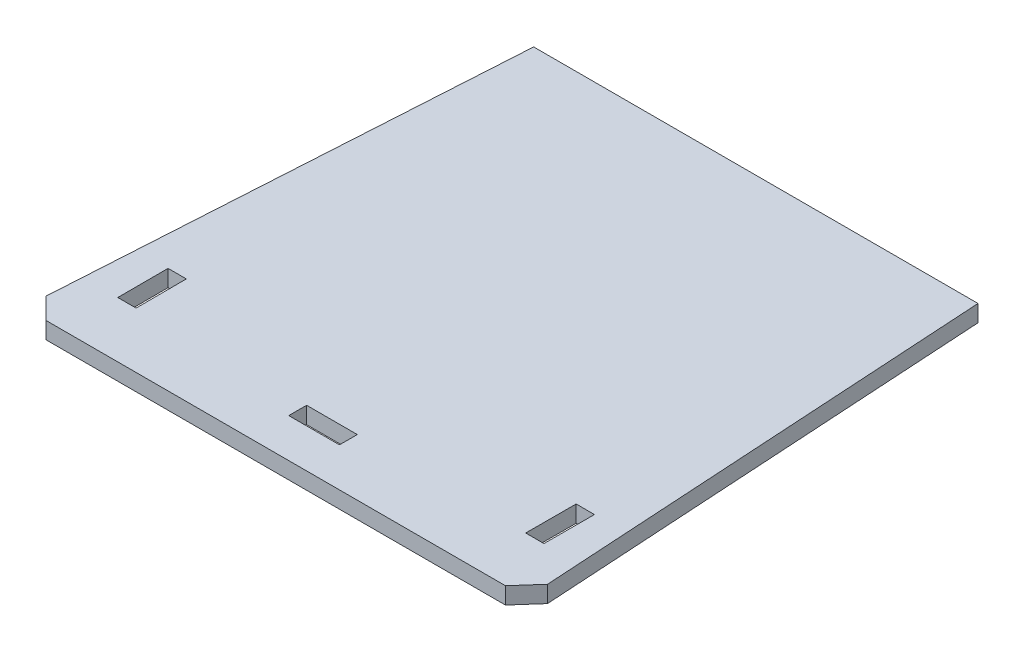
from build123d import *
from OCP.BRepFilletAPI import BRepFilletAPI_MakeChamfer

# Parameters (mm, degrees)
BOSS_EXTRUDE1_DEPTH = 15
CUT_EXTRUDE1_DEPTH  = 469.027776953
CHAMFER1_SIZE       = 20
CHAMFER1_SIZE2      = 18.885887556
SKETCH4_W           = 45.375817112
SKETCH4_H           = 15.979474245
CUT_EXTRUDE5_DEPTH  = 468.476442192


with BuildPart() as part:
    # Sketch1 → Boss-Extrude1 (new body)
    with BuildSketch(Plane(origin=(0, 0, 0), x_dir=(1, 0, 0), z_dir=(0, 1, 0))):
        Polygon((-225, -410.121933088), (-198.780229192, 20.01019046), (198.780229192, 20.01019046), (225, -410.121933088), align=None)
    extrude(amount=-BOSS_EXTRUDE1_DEPTH)

    # Sketch2 → Cut-Extrude1 (cut, through all)
    with BuildSketch(Plane.XZ.offset(15)):
        Polygon((190.662364216, 360.244932401), (190.758526229, 315.166919875), (174.389363372, 315.132000597), (174.293201359, 360.210013123), align=None)
    cut_extrude1 = extrude(amount=-CUT_EXTRUDE1_DEPTH, mode=Mode.SUBTRACT)

    # Mirror1: Cut-Extrude1 across plane
    add(cut_extrude1.mirror(Plane(origin=(0, 0, 0), x_dir=(0, 0, 1), z_dir=(1, 0, 0))), mode=Mode.SUBTRACT)

    # Chamfer1: one chamfer whose edges measure the first distance from different faces: ONE call of the kernel's chamfer builder (chamfer() names one face for all edges)
    chamfer1_edges_1 = [part.edges().sort_by_distance(p)[0] for p in [
        (-225, -7.5, 410.121933088),
    ]]
    chamfer1_side_1 = [part.faces().sort_by_distance(p)[0] for p in [
        (0, -7.5, 410.121933088),
    ]]
    chamfer1_edges_2 = [part.edges().sort_by_distance(p)[0] for p in [
        (225, -7.5, 410.121933088),
    ]]
    chamfer1_side_2 = [part.faces().sort_by_distance(p)[0] for p in [
        (211.890114596, -7.5, 195.055871314),
    ]]
    chamfer1 = BRepFilletAPI_MakeChamfer(part.part.solid().wrapped)
    for e in chamfer1_edges_1:
        chamfer1.Add(CHAMFER1_SIZE, CHAMFER1_SIZE2, e.wrapped, chamfer1_side_1[0].wrapped)  # the first distance lies on this face
    for e in chamfer1_edges_2:
        chamfer1.Add(CHAMFER1_SIZE, CHAMFER1_SIZE2, e.wrapped, chamfer1_side_2[0].wrapped)  # the first distance lies on this face
    add(Compound.cast(chamfer1.Shape()), mode=Mode.REPLACE)

    # Sketch4 → Cut-Extrude5 (cut, through all)
    with BuildSketch(Plane(origin=(0, 0, 0), x_dir=(1, 0, 0), z_dir=(0, 1, 0))):
        with Locations((0, -367.255161149)):
            Rectangle(SKETCH4_W, SKETCH4_H)
    extrude(amount=-CUT_EXTRUDE5_DEPTH, mode=Mode.SUBTRACT)


solid = part.part
